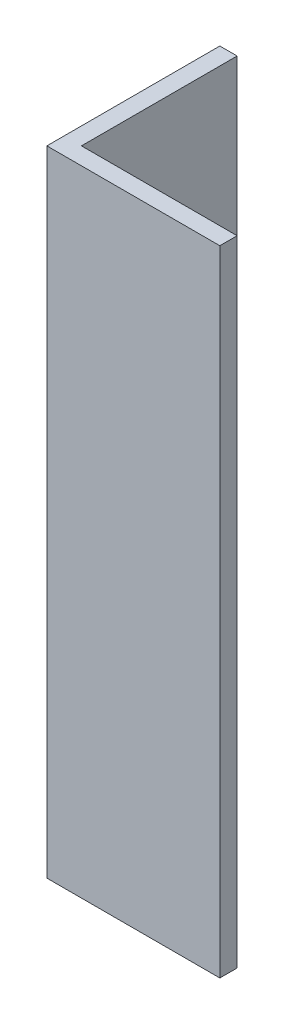
from build123d import *

# Parameters (mm, degrees)
BOSS_EXTRUDE1_DEPTH = 110


with BuildPart() as part:
    # Sketch1 → Boss-Extrude1 (new body)
    with BuildSketch(Plane(origin=(0, 0, 0), x_dir=(1, 0, 0), z_dir=(0, 1, 0))):
        Polygon((0, 0), (30, 0), (30, 3), (3, 3), (3, 30), (0, 30), align=None)
    extrude(amount=BOSS_EXTRUDE1_DEPTH)


solid = part.part
